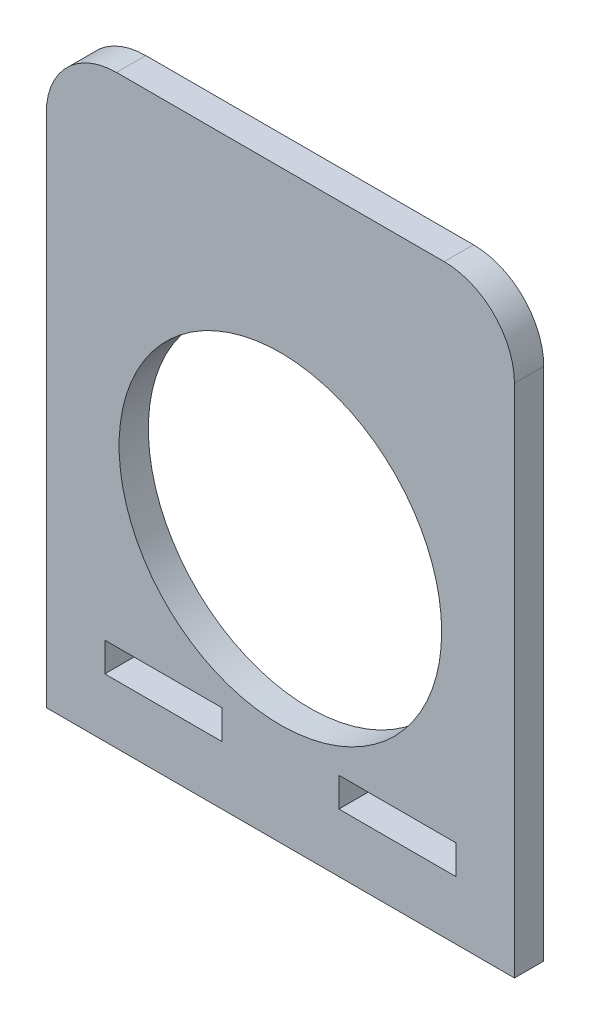
from build123d import *

# Parameters (mm, degrees)
SKETCH1_R           = 17.5
SKETCH1_W           = 12.7
SKETCH1_H           = 3.175
BOSS_EXTRUDE1_DEPTH = 3.175


with BuildPart() as part:
    # Sketch1 → Boss-Extrude1 (new body)
    with BuildSketch(Plane.XY):
        with BuildLine():
            Line((0, 0), (50.8, 0))
            Line((50.8, 0), (50.8, 55.88))
            ThreePointArc((50.8, 55.88), (48.568153673, 61.268153673), (43.18, 63.5))
            Line((43.18, 63.5), (7.62, 63.5))
            ThreePointArc((7.62, 63.5), (2.231846327, 61.268153673), (0, 55.88))
            Line((0, 55.88), (0, 0))
        make_face()
        with Locations((25.4, 28.575)):
            Circle(SKETCH1_R, mode=Mode.SUBTRACT)
        with Locations((12.7, 7.9375)):
            Rectangle(SKETCH1_W, SKETCH1_H, mode=Mode.SUBTRACT)
        with Locations((38.1, 7.9375)):
            Rectangle(SKETCH1_W, SKETCH1_H, mode=Mode.SUBTRACT)
    extrude(amount=BOSS_EXTRUDE1_DEPTH)


solid = part.part
